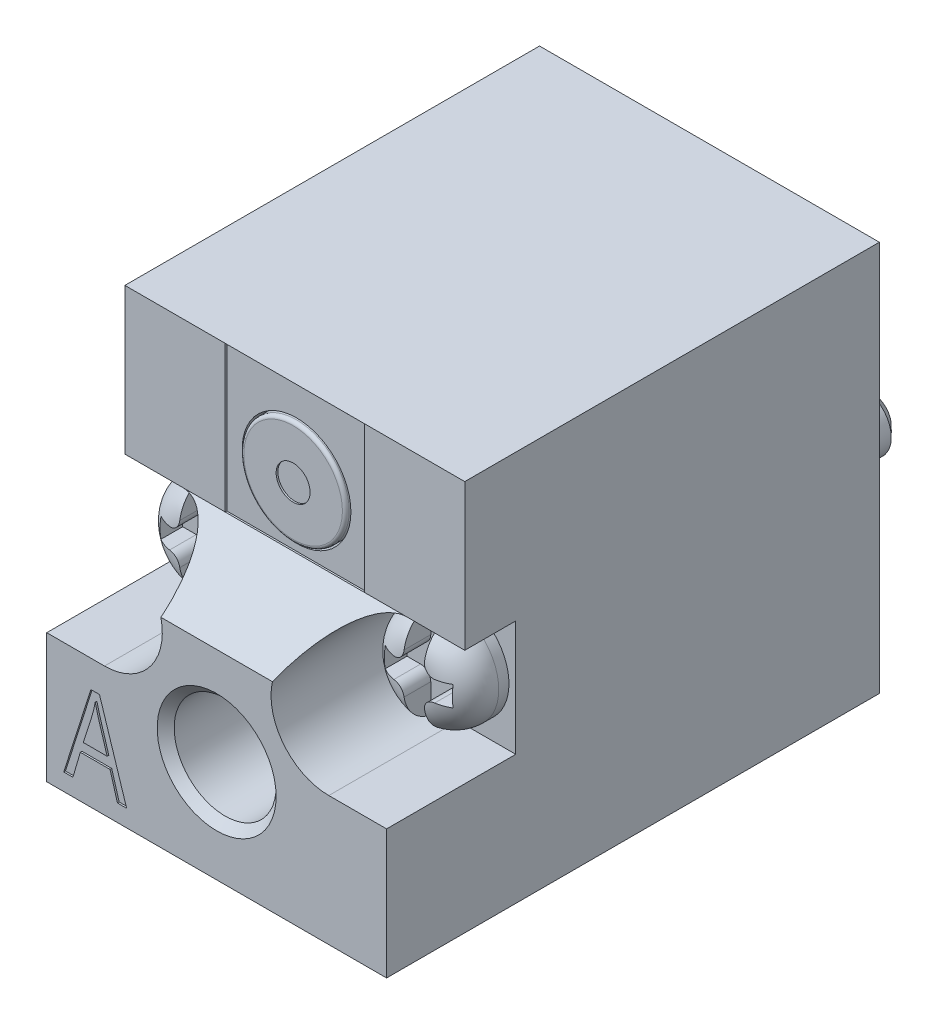
from build123d import *

# Parameters (mm, degrees)
SKETCH1_W           = 10
SKETCH1_H           = 11.5
BOSS_EXTRUDE1_DEPTH = 7.25
CUT_EXTRUDE1_DEPTH  = 17.876388832
CUT_EXTRUDE2_DEPTH  = 3.8
SKETCH4_R           = 1.5
BOSS_EXTRUDE2_DEPTH = 1.3
FILLET1_R           = 1
CUT_EXTRUDE3_DEPTH  = 0.8
SKETCH6_R           = 0.85
BOSS_EXTRUDE3_DEPTH = 1.5
CHAMFER1_SIZE       = 0.3
CUT_EXTRUDE4_DEPTH  = 0.05
SKETCH10_W          = 4.1
SKETCH10_H          = 4.3
CUT_EXTRUDE5_DEPTH  = 0.05
SKETCH11_R          = 1.6
CUT_EXTRUDE6_DEPTH  = 0.5
SKETCH12_R          = 1.55
BOSS_EXTRUDE4_DEPTH = 0.6
SKETCH13_R          = 0.5
CUT_EXTRUDE7_DEPTH  = 0.05
FILLET2_R           = 0.1


with BuildPart() as part:
    # Sketch1 → Boss-Extrude1 (new, symmetric)
    with BuildSketch(Plane.XY):
        with Locations((0, 5.75)):
            Rectangle(SKETCH1_W, SKETCH1_H)
    extrude(amount=BOSS_EXTRUDE1_DEPTH, both=True)

    # Sketch2 → Cut-Extrude1 (cut, through all)
    with BuildSketch(Plane(origin=(5, 0, 0), x_dir=(0, 0, -1), z_dir=(1, 0, 0))):
        Polygon((-7.25, 11.5), (-4.95, 11.5), (-4.95, 7.199905619), (-7.25, 5.872), align=None)
    extrude(amount=-CUT_EXTRUDE1_DEPTH, mode=Mode.SUBTRACT)

    # Sketch3 → Cut-Extrude2 (cut)
    with BuildSketch(Plane.XY.offset(7.25)):
        with BuildLine():
            Line((-5, 7.2), (-3.3, 7.2))
            ThreePointArc((-3.3, 7.2), (-1.6, 5.5), (-3.3, 3.8))
            Line((-3.3, 3.8), (-5, 3.8))
            Line((-5, 3.8), (-5, 7.2))
        make_face()
        with BuildLine():
            Line((5, 3.8), (3.3, 3.8))
            ThreePointArc((3.3, 3.8), (1.6, 5.5), (3.3, 7.2))
            Line((3.3, 7.2), (5, 7.2))
            Line((5, 7.2), (5, 3.8))
        make_face()
    extrude(amount=-CUT_EXTRUDE2_DEPTH, mode=Mode.SUBTRACT)

    # Sketch4 → Boss-Extrude2 (add)
    with BuildSketch(Plane.XY.offset(3.45)):
        with Locations((-3.3, 5.5)):
            Circle(SKETCH4_R)
        with Locations((3.3, 5.5)):
            Circle(SKETCH4_R)
    extrude(amount=BOSS_EXTRUDE2_DEPTH)

    # Fillet1
    fillet1_edges = [part.edges().sort_by_distance(p)[0] for p in [
        (1.8, 5.5, 4.75),
        (-4.8, 5.5, 4.75),
    ]]
    fillet(fillet1_edges, radius=FILLET1_R)

    # Sketch5 → Cut-Extrude3 (cut)
    with BuildSketch(Plane.XY.offset(4.75)):
        with BuildLine():
            Line((-3.6, 4.9), (-3.6, 4))
            Line((-3.6, 4), (-3, 4))
            Line((-3, 4), (-3, 4.9))
            ThreePointArc((-3, 4.9), (-2.912132034, 5.112132034), (-2.7, 5.2))
            Line((-2.7, 5.2), (-2.3, 5.2))
            Line((-2.3, 5.2), (-2.3, 5.8))
            Line((-2.3, 5.8), (-2.7, 5.8))
            ThreePointArc((-2.7, 5.8), (-2.912132034, 5.887867966), (-3, 6.1))
            Line((-3, 6.1), (-3, 7))
            Line((-3, 7), (-3.6, 7))
            Line((-3.6, 7), (-3.6, 6.1))
            ThreePointArc((-3.6, 6.1), (-3.687867966, 5.887867966), (-3.9, 5.8))
            Line((-3.9, 5.8), (-4.3, 5.8))
            Line((-4.3, 5.8), (-4.3, 5.2))
            Line((-4.3, 5.2), (-3.9, 5.2))
            ThreePointArc((-3.9, 5.2), (-3.687867966, 5.112132034), (-3.6, 4.9))
        make_face()
        with BuildLine():
            Line((3, 4), (3.6, 4))
            Line((3.6, 4), (3.6, 4.9))
            ThreePointArc((3.6, 4.9), (3.687867966, 5.112132034), (3.9, 5.2))
            Line((3.9, 5.2), (4.3, 5.2))
            Line((4.3, 5.2), (4.3, 5.8))
            Line((4.3, 5.8), (3.9, 5.8))
            ThreePointArc((3.9, 5.8), (3.687867966, 5.887867966), (3.6, 6.1))
            Line((3.6, 6.1), (3.6, 7))
            Line((3.6, 7), (3, 7))
            Line((3, 7), (3, 6.1))
            ThreePointArc((3, 6.1), (2.912132034, 5.887867966), (2.7, 5.8))
            Line((2.7, 5.8), (2.3, 5.8))
            Line((2.3, 5.8), (2.3, 5.2))
            Line((2.3, 5.2), (2.7, 5.2))
            ThreePointArc((2.7, 5.2), (2.912132034, 5.112132034), (3, 4.9))
            Line((3, 4.9), (3, 4))
        make_face()
    extrude(amount=-CUT_EXTRUDE3_DEPTH, mode=Mode.SUBTRACT)

    # Sketch6 → Boss-Extrude3 (add)
    with BuildSketch(Plane(origin=(0, 0, -7.25), x_dir=(-1, 0, 0), z_dir=(0, 0, -1))):
        with Locations((-3.3, 5.5)):
            Circle(SKETCH6_R)
        with Locations((3.3, 5.5)):
            Circle(SKETCH6_R)
    extrude(amount=BOSS_EXTRUDE3_DEPTH)

    # Chamfer1
    chamfer1_edges = [part.edges().sort_by_distance(p)[0] for p in [
        (-2.45, 5.5, -8.75),
        (4.15, 5.5, -8.75),
    ]]
    chamfer(chamfer1_edges, length=CHAMFER1_SIZE)

    # Sketch7 → M3x0.5 Tapped Hole1 (revolve, cut)
    with BuildSketch(Plane(origin=(0, 3, 7.25), x_dir=(0, -1, 0), z_dir=(1, 0, 0))):
        Polygon((0, 0), (0, 8.251075774), (1.25, 7.5), (1.25, 6), (1.5, 6), (1.5, 0.25), (1.75, 0), align=None)
    revolve(axis=Axis((0, 3, 13.6), (0, 0, -1)), mode=Mode.SUBTRACT)

    # Sketch9 → Cut-Extrude4 (cut)
    with BuildSketch(Plane.XY.offset(7.25)):
        Polygon((-4.5, 0.5), (-3.701501623, 3), (-3.448356331, 3), (-2.649350649, 0.5), (-2.919237013, 0.5), (-3.137885552, 1.246753247), (-4.011465097, 1.246753247), (-4.229606331, 0.5), align=None)
        with BuildLine():
            Line((-3.926237825, 1.538961039), (-3.22362013, 1.538961039))
            Line((-3.22362013, 1.538961039), (-3.43262987, 2.225852273))
            add(Edge.make_bspline(
                [(-3.43262987, 2.225852273), (-3.440448977, 2.251543738), (-3.455714643, 2.301702579), (-3.477332218, 2.37515056), (-3.498080179, 2.444814597), (-3.515802934, 2.511180634), (-3.533426101, 2.573385184), (-3.548624882, 2.632120481), (-3.562268322, 2.687095028), (-3.570649305, 2.72266533), (-3.574675325, 2.739752435)],
                knots=[0, 0, 0, 0, 1.20859176, 2.359599242, 3.445754582, 4.479676267, 5.450859039, 6.355343929, 7.209947359, 8, 8, 8, 8], degree=3))
            add(Edge.make_bspline(
                [(-3.574675325, 2.739752435), (-3.581984288, 2.699951915), (-3.596592506, 2.620403746), (-3.623975035, 2.501902002), (-3.65443893, 2.3836141), (-3.678687067, 2.30557538), (-3.690848214, 2.266436688)],
                knots=[0, 0, 0, 0, 0.995500629, 1.989678841, 2.991765375, 4, 4, 4, 4], degree=3))
            Line((-3.690848214, 2.266436688), (-3.926237825, 1.538961039))
        make_face(mode=Mode.SUBTRACT)
    extrude(amount=-CUT_EXTRUDE4_DEPTH, mode=Mode.SUBTRACT)

    # Sketch10 → Cut-Extrude5 (cut)
    with BuildSketch(Plane.XY.offset(4.95)):
        with Locations((0, 9.349905619)):
            Rectangle(SKETCH10_W, SKETCH10_H)
    extrude(amount=-CUT_EXTRUDE5_DEPTH, mode=Mode.SUBTRACT)

    # Sketch11 → Cut-Extrude6 (cut)
    with BuildSketch(Plane.XY.offset(4.9)):
        with Locations((0, 8.999905619)):
            Circle(SKETCH11_R)
    extrude(amount=-CUT_EXTRUDE6_DEPTH, mode=Mode.SUBTRACT)

    # Sketch12 → Boss-Extrude4 (add)
    with BuildSketch(Plane.XY.offset(4.4)):
        with Locations((0, 8.999905619)):
            Circle(SKETCH12_R)
    extrude(amount=BOSS_EXTRUDE4_DEPTH)

    # Sketch13 → Cut-Extrude7 (cut)
    with BuildSketch(Plane.XY.offset(5)):
        with Locations((0, 8.999905619)):
            Circle(SKETCH13_R)
    extrude(amount=-CUT_EXTRUDE7_DEPTH, mode=Mode.SUBTRACT)

    # Fillet2
    fillet2_edges = [part.edges().sort_by_distance(p)[0] for p in [
        (-1.55, 8.999905619, 5),
    ]]
    fillet(fillet2_edges, radius=FILLET2_R)


solid = part.part
